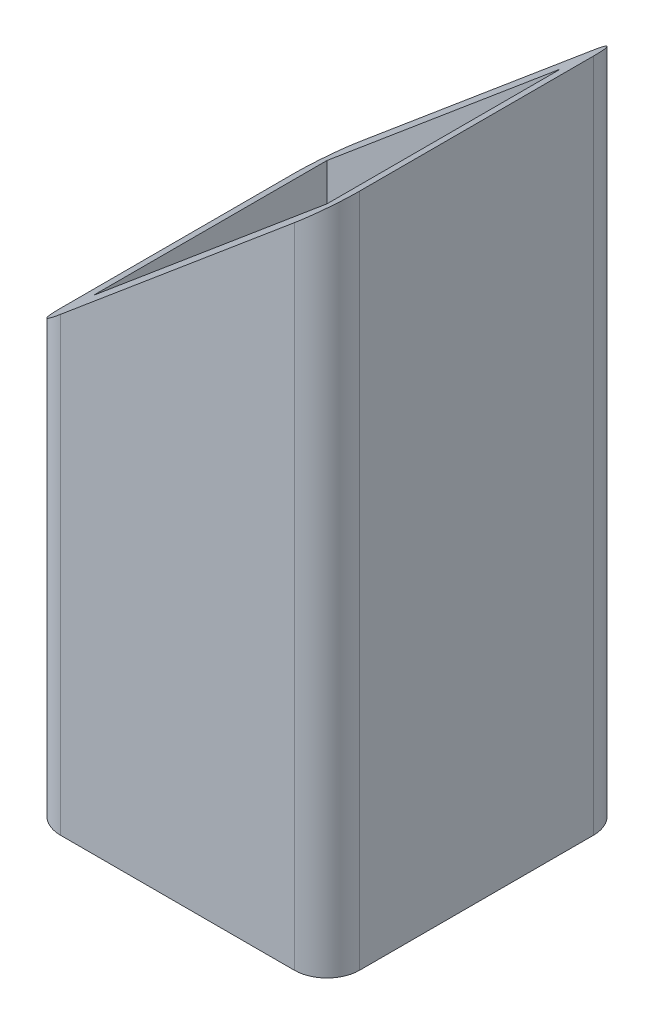
from build123d import *

# Parameters (mm, degrees)
BOSS_EXTRUDE1_DEPTH = 60
SKETCH3_W           = 20
SKETCH3_H           = 20
CUT_EXTRUDE1_DEPTH  = 1040.5
CUT_EXTRUDE2_REACH  = 72.077


with BuildPart() as part:
    # Sketch1 → Boss-Extrude1 (new body)
    with BuildSketch(Plane(origin=(0, 0, 0), x_dir=(1, 0, 0), z_dir=(0, 1, 0))):
        with BuildLine():
            Line((2.8, 0), (22.8, 0))
            ThreePointArc((22.8, 0), (24.779898987, -0.820101013), (25.6, -2.8))
            Line((25.6, -2.8), (25.6, -22.8))
            ThreePointArc((25.6, -22.8), (24.779898987, -24.779898987), (22.8, -25.6))
            Line((22.8, -25.6), (2.8, -25.6))
            ThreePointArc((2.8, -25.6), (0.820101013, -24.779898987), (0, -22.8))
            Line((0, -22.8), (0, -2.8))
            ThreePointArc((0, -2.8), (0.820101013, -0.820101013), (2.8, 0))
        make_face()
    extrude(amount=BOSS_EXTRUDE1_DEPTH)

    # Sketch3 → Cut-Extrude1 (cut)
    with BuildSketch(Plane(origin=(0, 0, 0), x_dir=(-1, 0, 0), z_dir=(0, -1, 0))):
        with Locations((-12.8, -12.8)):
            Rectangle(SKETCH3_W, SKETCH3_H)
    extrude(amount=-CUT_EXTRUDE1_DEPTH, mode=Mode.SUBTRACT)

    # Cut-Extrude2: up to this face of the body (flat: up to its plane)
    cut_extrude2_end = Plane(part.part.faces().sort_by_distance((12.8, 30, 0))[0])
    # Sketch4 → Cut-Extrude2 (cut, up to the picked face)
    with BuildSketch(Plane.XY.offset(25.6), mode=Mode.PRIVATE) as cut_extrude2_sk1:
        Polygon((-0.986658786, 35.401585719), (-0.986658786, 60), (27.022015216, 60), (27.022015216, 58.911274466), align=None)
    cut_extrude2_tool1 = split(extrude(cut_extrude2_sk1.sketch, amount=-CUT_EXTRUDE2_REACH, mode=Mode.PRIVATE), bisect_by=cut_extrude2_end, keep=Keep.BOTH, mode=Mode.PRIVATE)
    add(cut_extrude2_tool1.solids().sort_by(Axis((8.745273, 51.785147, 25.6), (0, 0, -1)))[0], mode=Mode.SUBTRACT)


solid = part.part
